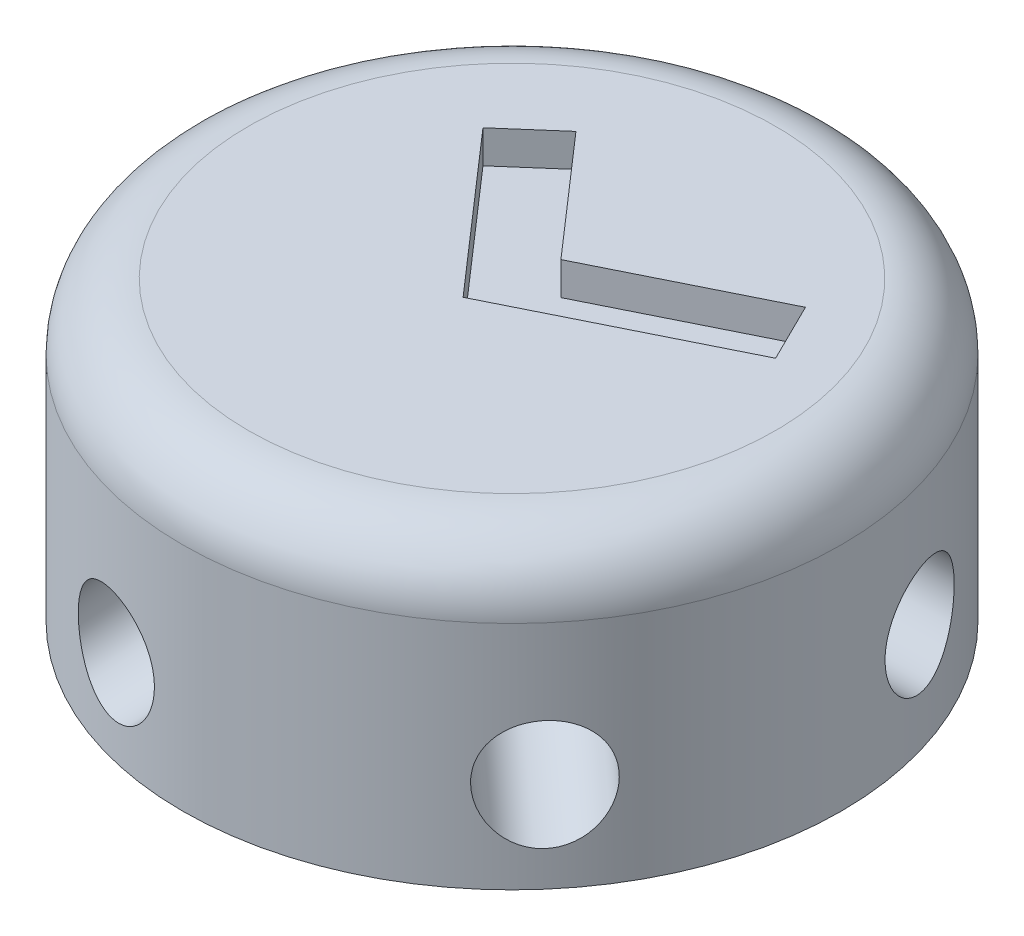
from build123d import *

# Parameters (mm, degrees)
BASE_DEPTH              = 3
BASE_DEPTH_BACK         = 6
SKETCH1_R               = 10
SKETCH3_R               = 1.6
HOLE2_DEPTH             = 19.1581212
HOLE2MIRROR_COUNT       = 2
SKETCH4_R               = 1.6
HOLE3_DEPTH             = 19.100993715
SKETCH5_R               = 1.6
CUT_EXTRUDE1_DEPTH      = 19.311666101
SKETCH6_R               = 1.6
CUT_EXTRUDE2_DEPTH      = 19.560472272
SKETCH7_R               = 1.6
CUT_EXTRUDE3_DEPTH      = 19.646604846
FILLET1_R               = 2
CUT_EXTRUDE_THIN1_DEPTH = 1


with BuildPart() as part:
    # Sketch1 → base (new, two sides: drawn at the far end of the back side and taken through both)
    with BuildSketch(Plane(origin=(0, 0, 0), x_dir=(1, 0, 0), z_dir=(0, 1, 0)).offset(-BASE_DEPTH_BACK)):
        Circle(SKETCH1_R)
    extrude(amount=BASE_DEPTH + BASE_DEPTH_BACK)

    # Sketch3 → hole2 (cut, through all)
    with BuildSketch(Plane(origin=(-0.941672921, -1.236067977, 3.685836142), x_dir=(-0.9718935871364875, 0.07382318789513377, -0.22354639834264944), z_dir=(0.23541823021467095, 0.3090169943749464, -0.921459035481267))):
        Circle(SKETCH3_R)
    hole2 = extrude(amount=-HOLE2_DEPTH, mode=Mode.SUBTRACT)

    # hole2mirror: hole2 ×2 about axis
    hole2mirror_axis = Axis((0, 5.5, 0), (0, -1, 0))
    for i in range(1, HOLE2MIRROR_COUNT):
        add(hole2.rotate(hole2mirror_axis, i * 360 / HOLE2MIRROR_COUNT), mode=Mode.SUBTRACT)

    # Sketch4 → hole3 (cut, through all)
    with BuildSketch(Plane(origin=(-3.717841, -1.236067977, 0.806098168), x_dir=(-0.19123247894507908, -0.06357892752956036, -0.979483465389136), z_dir=(0.9294602499075393, 0.30901699437494623, -0.20152454200243008))):
        Circle(SKETCH4_R)
    extrude(amount=-HOLE3_DEPTH, mode=Mode.SUBTRACT)

    # Sketch5 → Cut-Extrude1 (cut, through all)
    with BuildSketch(Plane(origin=(3.671965021, -1.093066116, -1.149730122), x_dir=(0.2754858058396647, -0.08200628219437099, 0.9578008876909271), z_dir=(-0.9179912552075574, 0.27326652891267317, 0.2874325304110031))):
        Circle(SKETCH5_R)
    extrude(amount=-CUT_EXTRUDE1_DEPTH, mode=Mode.SUBTRACT)

    # Sketch6 → Cut-Extrude2 (cut, through all)
    with BuildSketch(Plane(origin=(2.875583134, -1.236067977, 2.490613899), x_dir=(-0.5720437997755544, 0.24589274231852376, 0.782497699941298), z_dir=(-0.7188957835464718, 0.30901699437494723, -0.6226534747245682))):
        Circle(SKETCH6_R)
    extrude(amount=-CUT_EXTRUDE2_DEPTH, mode=Mode.SUBTRACT)

    # Sketch7 → Cut-Extrude3 (cut, through all)
    with BuildSketch(Plane(origin=(-2.670502563, -1.093066116, -2.770130417), x_dir=(0.7444971483747472, -0.2450509606833859, -0.6210265877802813), z_dir=(0.6676256406564008, 0.2732665289126714, 0.6925326043690294))):
        Circle(SKETCH7_R)
    extrude(amount=-CUT_EXTRUDE3_DEPTH, mode=Mode.SUBTRACT)

    # Fillet1
    fillet1_edges = [part.edges().sort_by_distance(p)[0] for p in [
        (-10, 3, 0),
    ]]
    fillet(fillet1_edges, radius=FILLET1_R)

    # Sketch9 → Cut-Extrude-Thin1 (cut)
    with BuildSketch(Plane(origin=(0, 3, 0), x_dir=(1, 0, 0), z_dir=(0, 1, 0))):
        Polygon((-4.40005736, 3.518760981), (-0.246688962, -1.237871846), (6.097894842, 1.902273668), (5.210740629, 3.694746095), (0.246688962, 1.237871846), (-2.893541545, 4.834211512), align=None)
    extrude(amount=-CUT_EXTRUDE_THIN1_DEPTH, mode=Mode.SUBTRACT)


solid = part.part
